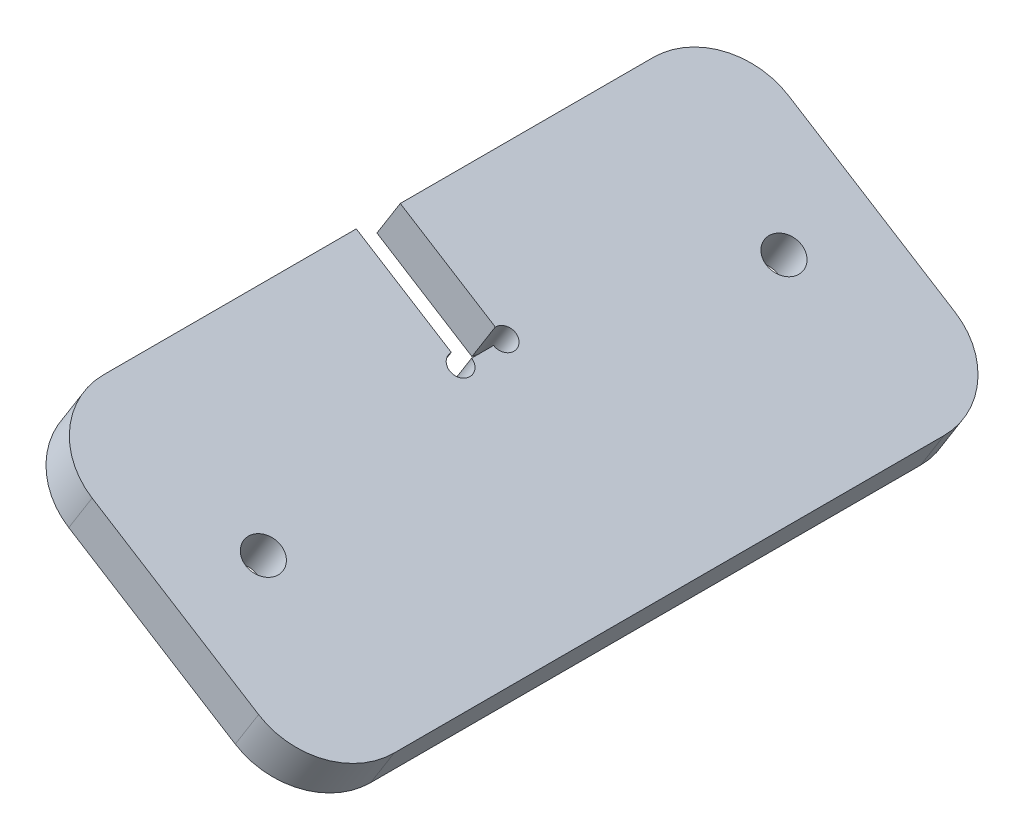
from build123d import *

# Parameters (mm, degrees)
BOSS_EXTRUDE1_DEPTH      = 44.5
BOSS_EXTRUDE1_DEPTH_BACK = 50.5
SKETCH2_W                = 16.785504055
SKETCH2_H                = 44.5
BOSS_EXTRUDE2_DEPTH      = 6
FILLET1_R                = 10
SKETCH3_R                = 1.5
SKETCH3_R_2              = 2.4
CUT_EXTRUDE1_DEPTH       = 549.376643642


with BuildPart() as part:
    # Sketch1 → Boss-Extrude1 (new, two sides: drawn at the far end of the back side and taken through both)
    with BuildSketch(Plane.XY.offset(-25).offset(-BOSS_EXTRUDE1_DEPTH_BACK)):
        Polygon((724, 137.920851515), (698.573213095, 153.84185989), (701.75741477, 158.927217271), (727.184201675, 143.006208896), align=None)
    extrude(amount=BOSS_EXTRUDE1_DEPTH + BOSS_EXTRUDE1_DEPTH_BACK)

    # Sketch2 → Boss-Extrude2 (add)
    with BuildSketch(Plane(origin=(269.130391352, 429.817066188, 0), x_dir=(0.8475595635030609, -0.5307002791731893, 0), z_dir=(0.5307002791731893, 0.8475595635030609, 0))):
        with Locations((502.045737546, 53.25)):
            Rectangle(SKETCH2_W, SKETCH2_H)
        with Locations((502.045737546, 2.75)):
            Rectangle(SKETCH2_W, SKETCH2_H)
    extrude(amount=-BOSS_EXTRUDE2_DEPTH)

    # Fillet1
    fillet1_edges = [part.edges().sort_by_distance(p)[0] for p in [
        (725.592100838, 140.463530205, -75.5),
        (725.592100838, 140.463530205, 19.5),
        (685.938599442, 165.292610269, -75.5),
        (685.938599442, 165.292610269, 19.5),
    ]]
    fillet(fillet1_edges, radius=FILLET1_R)

    # Sketch3 → Cut-Extrude1 (cut, through all)
    with BuildSketch(Plane(origin=(269.130391352, 429.817066188, 0), x_dir=(0.8475595635030609, -0.5307002791731893, 0), z_dir=(0.5307002791731893, 0.8475595635030609, 0))):
        with Locations((510.438489573, 25)):
            Circle(SKETCH3_R)
        with Locations((510.438489573, 31)):
            Circle(SKETCH3_R)
        with Locations(Location((517.045737546, -7.5, 0), (0, 0, 180))):
            Circle(SKETCH3_R_2)
        with Locations(Location((517.045737546, 63.5, 0), (0, 0, 180))):
            Circle(SKETCH3_R_2)
    extrude(amount=-CUT_EXTRUDE1_DEPTH, mode=Mode.SUBTRACT)


solid = part.part
